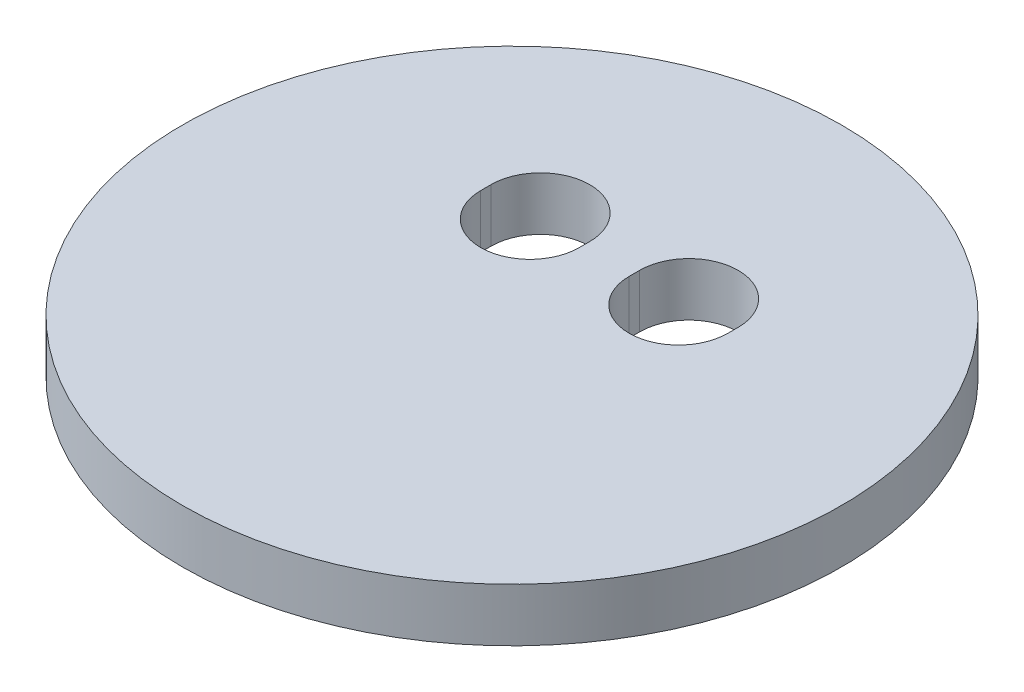
from build123d import *

# Parameters (mm, degrees)
SKETCH1_R           = 12.36
BOSS_EXTRUDE1_DEPTH = 2
CUT_EXTRUDE1_DEPTH  = 18.593726155


with BuildPart() as part:
    # Sketch1 → Boss-Extrude1 (new body)
    with BuildSketch(Plane(origin=(0, 0, 0), x_dir=(1, 0, 0), z_dir=(0, 1, 0))):
        with Locations(Location((0, 0, 0), (0, 0, 270))):
            Circle(SKETCH1_R)
    extrude(amount=BOSS_EXTRUDE1_DEPTH)

    # Sketch2 → Cut-Extrude1 (cut, through all)
    with BuildSketch(Plane(origin=(0, 2, 0), x_dir=(1, 0, 0), z_dir=(0, 1, 0))):
        with BuildLine():
            Line((4.635, 3.85), (4.635, 3.46))
            ThreePointArc((4.635, 3.46), (2.785, 1.61), (0.935, 3.46))
            Line((0.935, 3.46), (0.935, 3.85))
            ThreePointArc((0.935, 3.85), (2.785, 5.7), (4.635, 3.85))
        make_face()
        with BuildLine():
            Line((-0.935, 3.85), (-0.935, 3.46))
            ThreePointArc((-0.935, 3.46), (-2.785, 1.61), (-4.635, 3.46))
            Line((-4.635, 3.46), (-4.635, 3.85))
            ThreePointArc((-4.635, 3.85), (-2.785, 5.7), (-0.935, 3.85))
        make_face()
    extrude(amount=-CUT_EXTRUDE1_DEPTH, mode=Mode.SUBTRACT)


solid = part.part
